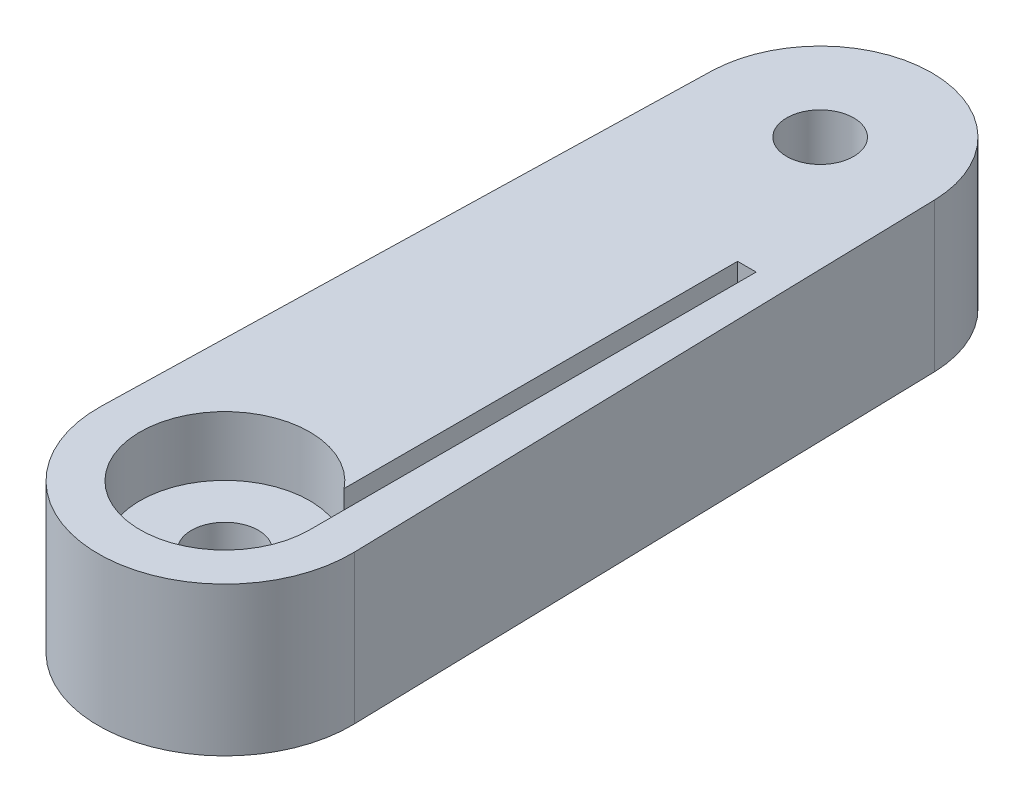
from build123d import *

# Parameters (mm, degrees)
SKETCH1_R           = 1.125
BOSS_EXTRUDE1_DEPTH = 5
CUT_EXTRUDE1_START  = -2
SKETCH2_R           = 1.125
CUT_EXTRUDE1_DEPTH  = 2
SKETCH3_R           = 1.125
CUT_EXTRUDE2_DEPTH  = 1.5
CUT_EXTRUDE3_DEPTH  = 2


with BuildPart() as part:
    # Sketch1 → Boss-Extrude1 (new body)
    with BuildSketch(Plane(origin=(0, 0, 0), x_dir=(1, 0, 0), z_dir=(0, 1, 0))):
        with BuildLine():
            Line((4.248671667, 0.10625), (3.748827942, 20.09375))
            ThreePointArc((3.748827942, 20.09375), (0, 23.75), (-3.748827942, 20.09375))
            Line((-3.748827942, 20.09375), (-4.248671667, 0.10625))
            ThreePointArc((-4.248671667, 0.10625), (0, -4.25), (4.248671667, 0.10625))
        make_face()
        Circle(SKETCH1_R, mode=Mode.SUBTRACT)
        with Locations((0, 20)):
            Circle(SKETCH1_R, mode=Mode.SUBTRACT)
    extrude(amount=BOSS_EXTRUDE1_DEPTH)

    # Sketch2 → Cut-Extrude1 (cut)
    # profile 1 of 2: a face of its own
    with BuildSketch(Plane(origin=(0, 5, 0), x_dir=(1, 0, 0), z_dir=(0, 1, 0)).offset(CUT_EXTRUDE1_START)):
        with BuildLine():
            ThreePointArc((2.225, 1.780975856), (-2.689214569, -0.943729304), (2.85, 0))
            ThreePointArc((2.85, 0), (2.689214569, 0.943729304), (2.225, 1.780975856))
        make_face()
        Circle(SKETCH2_R, mode=Mode.SUBTRACT)
    # profile 2 of 2: a face of its own
    with BuildSketch(Plane(origin=(0, 5, 0), x_dir=(1, 0, 0), z_dir=(0, 1, 0)).offset(CUT_EXTRUDE1_START)):
        with BuildLine():
            ThreePointArc((2.225, 1.780975856), (2.689214569, 0.943729304), (2.85, 0))
            Line((2.85, 0), (2.85, 15))
            Line((2.85, 15), (2.225, 15))
            Line((2.225, 15), (2.225, 1.780975856))
        make_face()
    extrude(amount=CUT_EXTRUDE1_DEPTH, mode=Mode.SUBTRACT)

    # Sketch3 → Cut-Extrude2 (cut)
    with BuildSketch(Plane.XZ):
        Polygon((2.125, 1.226869322), (0, 2.453738644), (-2.125, 1.226869322), (-2.125, -1.226869322), (0, -2.453738644), (2.125, -1.226869322), align=None)
        Circle(SKETCH3_R, mode=Mode.SUBTRACT)
    extrude(amount=-CUT_EXTRUDE2_DEPTH, mode=Mode.SUBTRACT)

    # Sketch3<3> → Cut-Extrude3 (cut)
    with BuildSketch(Plane.XZ):
        Polygon((2.125, -21.226869322), (0, -22.453738644), (-2.125, -21.226869322), (-2.125, -18.773130678), (0, -17.546261356), (2.125, -18.773130678), align=None)
    extrude(amount=-CUT_EXTRUDE3_DEPTH, mode=Mode.SUBTRACT)


solid = part.part
